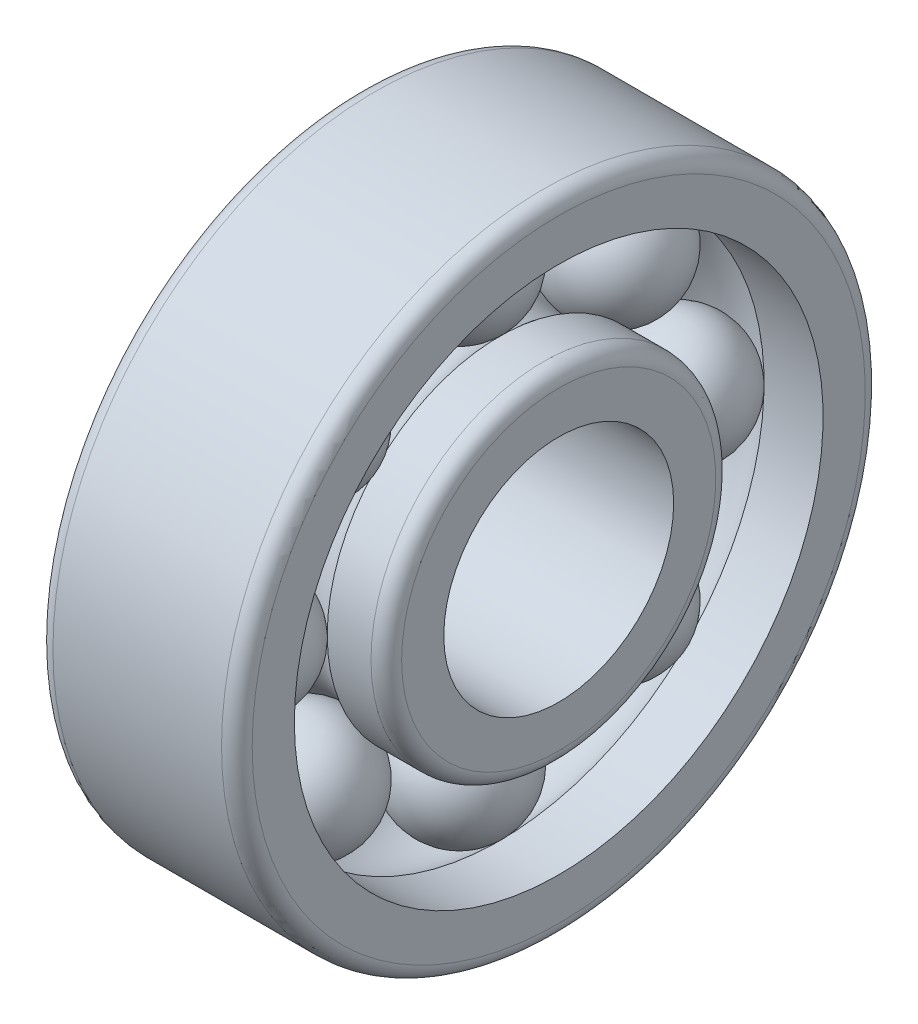
from build123d import *

# Parameters (mm, degrees)
CIRPATTERN2_COUNT = 8
FILLET1_R         = 1
FILLET3_R         = 1


with BuildPart() as part:
    # Sketch1 → Revolve1 (revolve)
    with BuildSketch(Plane.XY, mode=Mode.PRIVATE) as revolve1_sk:
        with BuildLine():
            Line((-6.5, 21), (-6.5, 17.25))
            Line((-6.5, 17.25), (-2.645751311, 17.25))
            ThreePointArc((-2.645751311, 17.25), (0, 18.25), (2.645751311, 17.25))
            Line((2.645751311, 17.25), (6.5, 17.25))
            Line((6.5, 17.25), (6.5, 21))
            Line((6.5, 21), (-6.5, 21))
        make_face()
        with BuildLine():
            Line((-6.5, 11.25), (-6.5, 7.5))
            Line((-6.5, 7.5), (6.5, 7.5))
            Line((6.5, 7.5), (6.5, 11.25))
            Line((6.5, 11.25), (2.645751311, 11.25))
            ThreePointArc((2.645751311, 11.25), (0, 10.25), (-2.645751311, 11.25))
            Line((-2.645751311, 11.25), (-6.5, 11.25))
        make_face()
    revolve(revolve1_sk.sketch.rotate(Axis((0, 0, 0), (1, 0, 0)), 90), axis=Axis((0, 0, 0), (1, 0, 0)))

    # Fillet1
    fillet1_edges = [part.edges().sort_by_distance(p)[0] for p in [
        (-6.5, 0, -21),
        (6.5, 0, -21),
    ]]
    fillet(fillet1_edges, radius=FILLET1_R)

    # Fillet3
    fillet3_edges = [part.edges().sort_by_distance(p)[0] for p in [
        (6.5, 0, -11.25),
        (-6.5, 0, -11.25),
    ]]
    fillet(fillet3_edges, radius=FILLET3_R)


with BuildPart() as body_2:
    # Sketch3 → Revolve2 (revolve)
    with BuildSketch(Plane(origin=(0, 0, 0), x_dir=(0, 0, -1), z_dir=(1, 0, 0))):
        with BuildLine():
            Line((0, 18.25), (0, 10.25))
            ThreePointArc((0, 10.25), (4, 14.25), (0, 18.25))
        make_face()
    revolve(axis=Axis((0, 18.25, 0), (0, -1, 0)))


with BuildPart() as cirpattern2_1:
    # CirPattern2: pattern copy
    add(body_2.part.rotate(Axis((0, 0, 0), (1, 0, 0)), 1 * 360 / CIRPATTERN2_COUNT))


with BuildPart() as cirpattern2_2:
    # CirPattern2: pattern copy
    add(body_2.part.rotate(Axis((0, 0, 0), (1, 0, 0)), 2 * 360 / CIRPATTERN2_COUNT))


with BuildPart() as cirpattern2_3:
    # CirPattern2: pattern copy
    add(body_2.part.rotate(Axis((0, 0, 0), (1, 0, 0)), 3 * 360 / CIRPATTERN2_COUNT))


with BuildPart() as cirpattern2_4:
    # CirPattern2: pattern copy
    add(body_2.part.rotate(Axis((0, 0, 0), (1, 0, 0)), 4 * 360 / CIRPATTERN2_COUNT))


with BuildPart() as cirpattern2_5:
    # CirPattern2: pattern copy
    add(body_2.part.rotate(Axis((0, 0, 0), (1, 0, 0)), 5 * 360 / CIRPATTERN2_COUNT))


with BuildPart() as cirpattern2_6:
    # CirPattern2: pattern copy
    add(body_2.part.rotate(Axis((0, 0, 0), (1, 0, 0)), 6 * 360 / CIRPATTERN2_COUNT))


with BuildPart() as cirpattern2_7:
    # CirPattern2: pattern copy
    add(body_2.part.rotate(Axis((0, 0, 0), (1, 0, 0)), 7 * 360 / CIRPATTERN2_COUNT))


solid = Compound([part.part, body_2.part, cirpattern2_1.part, cirpattern2_2.part, cirpattern2_3.part, cirpattern2_4.part, cirpattern2_5.part, cirpattern2_6.part, cirpattern2_7.part])
